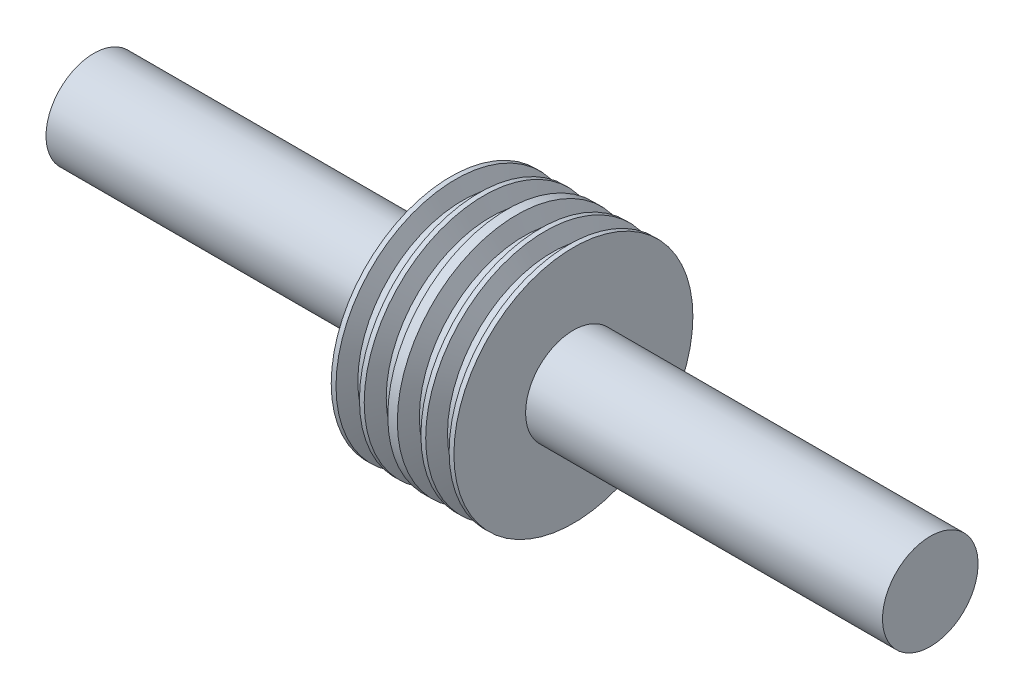
from build123d import *


with BuildPart() as part:
    # Sketch1 → Revolve1 (revolve)
    with BuildSketch(Plane.XY, mode=Mode.PRIVATE) as revolve1_sk:
        Polygon((35.4, 10), (35.98589676, 8.743540344), (36.78589676, 8.743540344), (37.37179352, 10), (37.77179352, 10), (38.352443595, 8.754791895), (39.152443595, 8.754791895), (39.73309367, 10), (40.13309367, 10), (40.13309367, 4), (70, 4), (70, 0), (0, 0), (0, 4), (29.86690633, 4), (29.86690633, 10), (30.26690633, 10), (30.847556405, 8.754791895), (31.647556405, 8.754791895), (32.22820648, 10), (32.62820648, 10), (33.21410324, 8.743540344), (34.01410324, 8.743540344), (34.6, 10), align=None)
    revolve(revolve1_sk.sketch.rotate(Axis((0, 0, 0), (1, 0, 0)), 90), axis=Axis((0, 0, 0), (1, 0, 0)))


solid = part.part
